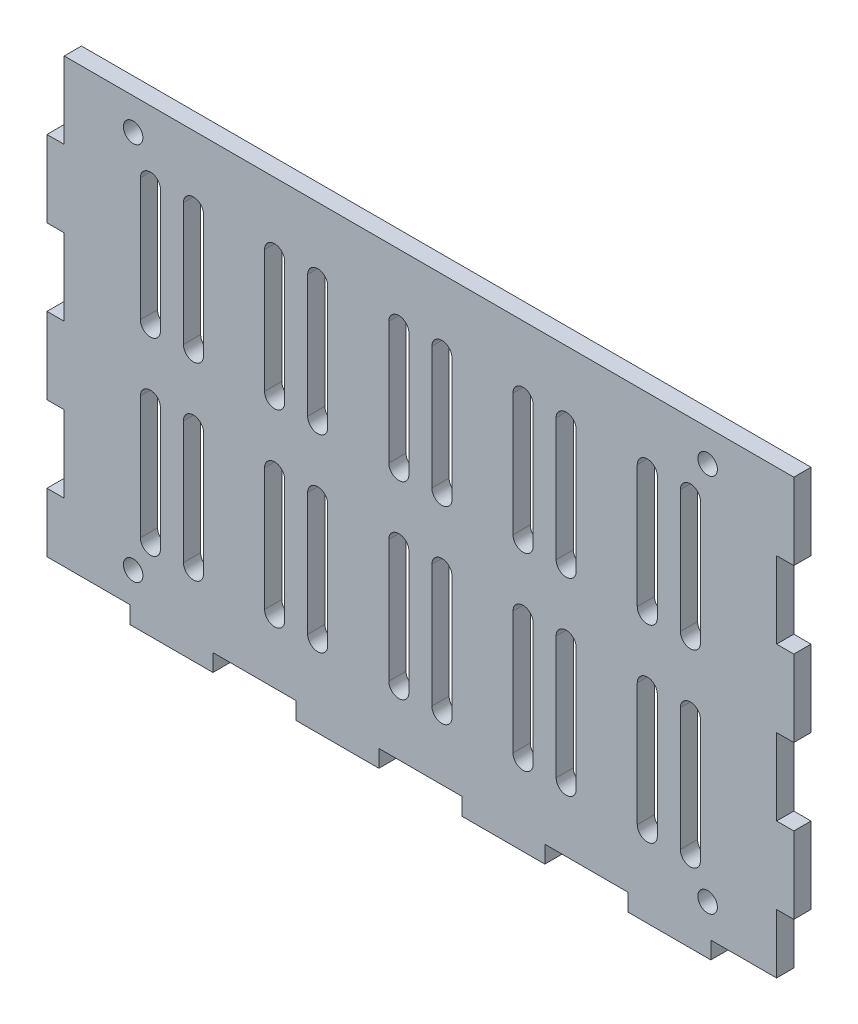
from build123d import *

# Parameters (mm, degrees)
SKETCH1_W               = 130
SKETCH1_H               = 80
BOSS_EXTRUDE1_DEPTH     = 3
SKETCH2_W               = 14.444444444
SKETCH2_H               = 3
SKETCH2_W_2             = 3
SKETCH2_H_2             = 13.333333334
SKETCH2_H_3             = 13.333333333
CUT_TABS_DEPTH          = 153.672852859
CORNERPIECE_HOLES_REACH = 154.673
SKETCH3_R               = 1.7
COOLING_SLOTS_REACH     = 154.673


with BuildPart() as part:
    # Sketch1 → Boss-Extrude1 (new body)
    with BuildSketch(Plane.XY):
        with Locations((65, 40)):
            Rectangle(SKETCH1_W, SKETCH1_H)
    extrude(amount=BOSS_EXTRUDE1_DEPTH)

    # Sketch2 → Cut tabs (cut, through all)
    with BuildSketch(Plane.XY.offset(3)):
        with Locations((7.222222222, 1.5)):
            Rectangle(SKETCH2_W, SKETCH2_H)
        with Locations((36.111111111, 1.5)):
            Rectangle(SKETCH2_W, SKETCH2_H)
        with Locations((65, 1.5)):
            Rectangle(SKETCH2_W, SKETCH2_H)
        with Locations((93.888888889, 1.5)):
            Rectangle(SKETCH2_W, SKETCH2_H)
        Polygon((115.555555556, 0), (115.555555556, 3), (127, 3), (127, 13.333333333), (130, 13.333333333), (130, 0), align=None)
        with Locations((1.5, 20)):
            Rectangle(SKETCH2_W_2, SKETCH2_H_2)
        with Locations((1.5, 46.666666667)):
            Rectangle(SKETCH2_W_2, SKETCH2_H_3)
        with Locations((1.5, 73.333333334)):
            Rectangle(SKETCH2_W_2, SKETCH2_H_3)
        with Locations((128.5, 33.333333334)):
            Rectangle(SKETCH2_W_2, SKETCH2_H_3)
        with Locations((128.5, 60)):
            Rectangle(SKETCH2_W_2, SKETCH2_H_2)
    extrude(amount=-CUT_TABS_DEPTH, mode=Mode.SUBTRACT)

    # Sketch3 → Cornerpiece holes (cut, up to next)
    with BuildSketch(Plane.XY.offset(3), mode=Mode.PRIVATE) as cornerpiece_holes_sk1:
        with Locations((15, 74.5)):
            Circle(SKETCH3_R)
    cornerpiece_holes_tool1 = extrude(cornerpiece_holes_sk1.sketch, amount=-CORNERPIECE_HOLES_REACH, mode=Mode.PRIVATE) & part.part
    # Sketch3 → Cornerpiece holes (cut, up to next)
    with BuildSketch(Plane.XY.offset(3), mode=Mode.PRIVATE) as cornerpiece_holes_sk2:
        with Locations((115, 74.5)):
            Circle(SKETCH3_R)
    cornerpiece_holes_tool2 = extrude(cornerpiece_holes_sk2.sketch, amount=-CORNERPIECE_HOLES_REACH, mode=Mode.PRIVATE) & part.part
    # Sketch3 → Cornerpiece holes (cut, up to next)
    with BuildSketch(Plane.XY.offset(3), mode=Mode.PRIVATE) as cornerpiece_holes_sk3:
        with Locations((15, 8.5)):
            Circle(SKETCH3_R)
    cornerpiece_holes_tool3 = extrude(cornerpiece_holes_sk3.sketch, amount=-CORNERPIECE_HOLES_REACH, mode=Mode.PRIVATE) & part.part
    # Sketch3 → Cornerpiece holes (cut, up to next)
    with BuildSketch(Plane.XY.offset(3), mode=Mode.PRIVATE) as cornerpiece_holes_sk4:
        with Locations((115, 8.5)):
            Circle(SKETCH3_R)
    cornerpiece_holes_tool4 = extrude(cornerpiece_holes_sk4.sketch, amount=-CORNERPIECE_HOLES_REACH, mode=Mode.PRIVATE) & part.part
    add(cornerpiece_holes_tool1.solids().sort_by_distance((15, 74.5, 3))[0], mode=Mode.SUBTRACT)
    add(cornerpiece_holes_tool2.solids().sort_by_distance((115, 74.5, 3))[0], mode=Mode.SUBTRACT)
    add(cornerpiece_holes_tool3.solids().sort_by_distance((15, 8.5, 3))[0], mode=Mode.SUBTRACT)
    add(cornerpiece_holes_tool4.solids().sort_by_distance((115, 8.5, 3))[0], mode=Mode.SUBTRACT)

    # Sketch4 → Cooling slots (cut, up to next)
    with BuildSketch(Plane.XY.offset(3), mode=Mode.PRIVATE) as cooling_slots_sk1:
        with BuildLine():
            Line((16.25, 14), (16.25, 35.375))
            ThreePointArc((16.25, 35.375), (18, 37.125), (19.75, 35.375))
            Line((19.75, 35.375), (19.75, 14))
            ThreePointArc((19.75, 14), (18, 12.25), (16.25, 14))
        make_face()
    cooling_slots_tool1 = extrude(cooling_slots_sk1.sketch, amount=-COOLING_SLOTS_REACH, mode=Mode.PRIVATE) & part.part
    # Sketch4 → Cooling slots (cut, up to next)
    with BuildSketch(Plane.XY.offset(3), mode=Mode.PRIVATE) as cooling_slots_sk2:
        with BuildLine():
            Line((16.25, 46.875), (16.25, 68.25))
            ThreePointArc((16.25, 68.25), (18, 70), (19.75, 68.25))
            Line((19.75, 68.25), (19.75, 46.875))
            ThreePointArc((19.75, 46.875), (18, 45.125), (16.25, 46.875))
        make_face()
    cooling_slots_tool2 = extrude(cooling_slots_sk2.sketch, amount=-COOLING_SLOTS_REACH, mode=Mode.PRIVATE) & part.part
    # Sketch4 → Cooling slots (cut, up to next)
    with BuildSketch(Plane.XY.offset(3), mode=Mode.PRIVATE) as cooling_slots_sk3:
        with BuildLine():
            Line((23.75, 14), (23.75, 35.375))
            ThreePointArc((23.75, 35.375), (25.5, 37.125), (27.25, 35.375))
            Line((27.25, 35.375), (27.25, 14))
            ThreePointArc((27.25, 14), (25.5, 12.25), (23.75, 14))
        make_face()
    cooling_slots_tool3 = extrude(cooling_slots_sk3.sketch, amount=-COOLING_SLOTS_REACH, mode=Mode.PRIVATE) & part.part
    # Sketch4 → Cooling slots (cut, up to next)
    with BuildSketch(Plane.XY.offset(3), mode=Mode.PRIVATE) as cooling_slots_sk4:
        with BuildLine():
            Line((23.75, 46.875), (23.75, 68.25))
            ThreePointArc((23.75, 68.25), (25.5, 70), (27.25, 68.25))
            Line((27.25, 68.25), (27.25, 46.875))
            ThreePointArc((27.25, 46.875), (25.5, 45.125), (23.75, 46.875))
        make_face()
    cooling_slots_tool4 = extrude(cooling_slots_sk4.sketch, amount=-COOLING_SLOTS_REACH, mode=Mode.PRIVATE) & part.part
    # Sketch4 → Cooling slots (cut, up to next)
    with BuildSketch(Plane.XY.offset(3), mode=Mode.PRIVATE) as cooling_slots_sk5:
        with BuildLine():
            Line((41.375, 14), (41.375, 35.375))
            ThreePointArc((41.375, 35.375), (39.625, 37.125), (37.875, 35.375))
            Line((37.875, 35.375), (37.875, 14))
            ThreePointArc((37.875, 14), (39.625, 12.25), (41.375, 14))
        make_face()
    cooling_slots_tool5 = extrude(cooling_slots_sk5.sketch, amount=-COOLING_SLOTS_REACH, mode=Mode.PRIVATE) & part.part
    # Sketch4 → Cooling slots (cut, up to next)
    with BuildSketch(Plane.XY.offset(3), mode=Mode.PRIVATE) as cooling_slots_sk6:
        with BuildLine():
            Line((48.875, 14), (48.875, 35.375))
            ThreePointArc((48.875, 35.375), (47.125, 37.125), (45.375, 35.375))
            Line((45.375, 35.375), (45.375, 14))
            ThreePointArc((45.375, 14), (47.125, 12.25), (48.875, 14))
        make_face()
    cooling_slots_tool6 = extrude(cooling_slots_sk6.sketch, amount=-COOLING_SLOTS_REACH, mode=Mode.PRIVATE) & part.part
    # Sketch4 → Cooling slots (cut, up to next)
    with BuildSketch(Plane.XY.offset(3), mode=Mode.PRIVATE) as cooling_slots_sk7:
        with BuildLine():
            Line((48.875, 46.875), (48.875, 68.25))
            ThreePointArc((48.875, 68.25), (47.125, 70), (45.375, 68.25))
            Line((45.375, 68.25), (45.375, 46.875))
            ThreePointArc((45.375, 46.875), (47.125, 45.125), (48.875, 46.875))
        make_face()
    cooling_slots_tool7 = extrude(cooling_slots_sk7.sketch, amount=-COOLING_SLOTS_REACH, mode=Mode.PRIVATE) & part.part
    # Sketch4 → Cooling slots (cut, up to next)
    with BuildSketch(Plane.XY.offset(3), mode=Mode.PRIVATE) as cooling_slots_sk8:
        with BuildLine():
            Line((41.375, 46.875), (41.375, 68.25))
            ThreePointArc((41.375, 68.25), (39.625, 70), (37.875, 68.25))
            Line((37.875, 68.25), (37.875, 46.875))
            ThreePointArc((37.875, 46.875), (39.625, 45.125), (41.375, 46.875))
        make_face()
    cooling_slots_tool8 = extrude(cooling_slots_sk8.sketch, amount=-COOLING_SLOTS_REACH, mode=Mode.PRIVATE) & part.part
    # Sketch4 → Cooling slots (cut, up to next)
    with BuildSketch(Plane.XY.offset(3), mode=Mode.PRIVATE) as cooling_slots_sk9:
        with BuildLine():
            Line((63, 14), (63, 35.375))
            ThreePointArc((63, 35.375), (61.25, 37.125), (59.5, 35.375))
            Line((59.5, 35.375), (59.5, 14))
            ThreePointArc((59.5, 14), (61.25, 12.25), (63, 14))
        make_face()
    cooling_slots_tool9 = extrude(cooling_slots_sk9.sketch, amount=-COOLING_SLOTS_REACH, mode=Mode.PRIVATE) & part.part
    # Sketch4 → Cooling slots (cut, up to next)
    with BuildSketch(Plane.XY.offset(3), mode=Mode.PRIVATE) as cooling_slots_sk10:
        with BuildLine():
            Line((70.5, 14), (70.5, 35.375))
            ThreePointArc((70.5, 35.375), (68.75, 37.125), (67, 35.375))
            Line((67, 35.375), (67, 14))
            ThreePointArc((67, 14), (68.75, 12.25), (70.5, 14))
        make_face()
    cooling_slots_tool10 = extrude(cooling_slots_sk10.sketch, amount=-COOLING_SLOTS_REACH, mode=Mode.PRIVATE) & part.part
    # Sketch4 → Cooling slots (cut, up to next)
    with BuildSketch(Plane.XY.offset(3), mode=Mode.PRIVATE) as cooling_slots_sk11:
        with BuildLine():
            Line((70.5, 46.875), (70.5, 68.25))
            ThreePointArc((70.5, 68.25), (68.75, 70), (67, 68.25))
            Line((67, 68.25), (67, 46.875))
            ThreePointArc((67, 46.875), (68.75, 45.125), (70.5, 46.875))
        make_face()
    cooling_slots_tool11 = extrude(cooling_slots_sk11.sketch, amount=-COOLING_SLOTS_REACH, mode=Mode.PRIVATE) & part.part
    # Sketch4 → Cooling slots (cut, up to next)
    with BuildSketch(Plane.XY.offset(3), mode=Mode.PRIVATE) as cooling_slots_sk12:
        with BuildLine():
            Line((63, 46.875), (63, 68.25))
            ThreePointArc((63, 68.25), (61.25, 70), (59.5, 68.25))
            Line((59.5, 68.25), (59.5, 46.875))
            ThreePointArc((59.5, 46.875), (61.25, 45.125), (63, 46.875))
        make_face()
    cooling_slots_tool12 = extrude(cooling_slots_sk12.sketch, amount=-COOLING_SLOTS_REACH, mode=Mode.PRIVATE) & part.part
    # Sketch4 → Cooling slots (cut, up to next)
    with BuildSketch(Plane.XY.offset(3), mode=Mode.PRIVATE) as cooling_slots_sk13:
        with BuildLine():
            Line((84.625, 14), (84.625, 35.375))
            ThreePointArc((84.625, 35.375), (82.875, 37.125), (81.125, 35.375))
            Line((81.125, 35.375), (81.125, 14))
            ThreePointArc((81.125, 14), (82.875, 12.25), (84.625, 14))
        make_face()
    cooling_slots_tool13 = extrude(cooling_slots_sk13.sketch, amount=-COOLING_SLOTS_REACH, mode=Mode.PRIVATE) & part.part
    # Sketch4 → Cooling slots (cut, up to next)
    with BuildSketch(Plane.XY.offset(3), mode=Mode.PRIVATE) as cooling_slots_sk14:
        with BuildLine():
            Line((92.125, 14), (92.125, 35.375))
            ThreePointArc((92.125, 35.375), (90.375, 37.125), (88.625, 35.375))
            Line((88.625, 35.375), (88.625, 14))
            ThreePointArc((88.625, 14), (90.375, 12.25), (92.125, 14))
        make_face()
    cooling_slots_tool14 = extrude(cooling_slots_sk14.sketch, amount=-COOLING_SLOTS_REACH, mode=Mode.PRIVATE) & part.part
    # Sketch4 → Cooling slots (cut, up to next)
    with BuildSketch(Plane.XY.offset(3), mode=Mode.PRIVATE) as cooling_slots_sk15:
        with BuildLine():
            Line((92.125, 46.875), (92.125, 68.25))
            ThreePointArc((92.125, 68.25), (90.375, 70), (88.625, 68.25))
            Line((88.625, 68.25), (88.625, 46.875))
            ThreePointArc((88.625, 46.875), (90.375, 45.125), (92.125, 46.875))
        make_face()
    cooling_slots_tool15 = extrude(cooling_slots_sk15.sketch, amount=-COOLING_SLOTS_REACH, mode=Mode.PRIVATE) & part.part
    # Sketch4 → Cooling slots (cut, up to next)
    with BuildSketch(Plane.XY.offset(3), mode=Mode.PRIVATE) as cooling_slots_sk16:
        with BuildLine():
            Line((84.625, 46.875), (84.625, 68.25))
            ThreePointArc((84.625, 68.25), (82.875, 70), (81.125, 68.25))
            Line((81.125, 68.25), (81.125, 46.875))
            ThreePointArc((81.125, 46.875), (82.875, 45.125), (84.625, 46.875))
        make_face()
    cooling_slots_tool16 = extrude(cooling_slots_sk16.sketch, amount=-COOLING_SLOTS_REACH, mode=Mode.PRIVATE) & part.part
    # Sketch4 → Cooling slots (cut, up to next)
    with BuildSketch(Plane.XY.offset(3), mode=Mode.PRIVATE) as cooling_slots_sk17:
        with BuildLine():
            Line((106.25, 14), (106.25, 35.375))
            ThreePointArc((106.25, 35.375), (104.5, 37.125), (102.75, 35.375))
            Line((102.75, 35.375), (102.75, 14))
            ThreePointArc((102.75, 14), (104.5, 12.25), (106.25, 14))
        make_face()
    cooling_slots_tool17 = extrude(cooling_slots_sk17.sketch, amount=-COOLING_SLOTS_REACH, mode=Mode.PRIVATE) & part.part
    # Sketch4 → Cooling slots (cut, up to next)
    with BuildSketch(Plane.XY.offset(3), mode=Mode.PRIVATE) as cooling_slots_sk18:
        with BuildLine():
            Line((113.75, 14), (113.75, 35.375))
            ThreePointArc((113.75, 35.375), (112, 37.125), (110.25, 35.375))
            Line((110.25, 35.375), (110.25, 14))
            ThreePointArc((110.25, 14), (112, 12.25), (113.75, 14))
        make_face()
    cooling_slots_tool18 = extrude(cooling_slots_sk18.sketch, amount=-COOLING_SLOTS_REACH, mode=Mode.PRIVATE) & part.part
    # Sketch4 → Cooling slots (cut, up to next)
    with BuildSketch(Plane.XY.offset(3), mode=Mode.PRIVATE) as cooling_slots_sk19:
        with BuildLine():
            Line((113.75, 46.875), (113.75, 68.25))
            ThreePointArc((113.75, 68.25), (112, 70), (110.25, 68.25))
            Line((110.25, 68.25), (110.25, 46.875))
            ThreePointArc((110.25, 46.875), (112, 45.125), (113.75, 46.875))
        make_face()
    cooling_slots_tool19 = extrude(cooling_slots_sk19.sketch, amount=-COOLING_SLOTS_REACH, mode=Mode.PRIVATE) & part.part
    # Sketch4 → Cooling slots (cut, up to next)
    with BuildSketch(Plane.XY.offset(3), mode=Mode.PRIVATE) as cooling_slots_sk20:
        with BuildLine():
            Line((106.25, 46.875), (106.25, 68.25))
            ThreePointArc((106.25, 68.25), (104.5, 70), (102.75, 68.25))
            Line((102.75, 68.25), (102.75, 46.875))
            ThreePointArc((102.75, 46.875), (104.5, 45.125), (106.25, 46.875))
        make_face()
    cooling_slots_tool20 = extrude(cooling_slots_sk20.sketch, amount=-COOLING_SLOTS_REACH, mode=Mode.PRIVATE) & part.part
    add(cooling_slots_tool1.solids().sort_by_distance((18, 24.6875, 3))[0], mode=Mode.SUBTRACT)
    add(cooling_slots_tool2.solids().sort_by_distance((18, 57.5625, 3))[0], mode=Mode.SUBTRACT)
    add(cooling_slots_tool3.solids().sort_by_distance((25.5, 24.6875, 3))[0], mode=Mode.SUBTRACT)
    add(cooling_slots_tool4.solids().sort_by_distance((25.5, 57.5625, 3))[0], mode=Mode.SUBTRACT)
    add(cooling_slots_tool5.solids().sort_by_distance((39.625, 24.6875, 3))[0], mode=Mode.SUBTRACT)
    add(cooling_slots_tool6.solids().sort_by_distance((47.125, 24.6875, 3))[0], mode=Mode.SUBTRACT)
    add(cooling_slots_tool7.solids().sort_by_distance((47.125, 57.5625, 3))[0], mode=Mode.SUBTRACT)
    add(cooling_slots_tool8.solids().sort_by_distance((39.625, 57.5625, 3))[0], mode=Mode.SUBTRACT)
    add(cooling_slots_tool9.solids().sort_by_distance((61.25, 24.6875, 3))[0], mode=Mode.SUBTRACT)
    add(cooling_slots_tool10.solids().sort_by_distance((68.75, 24.6875, 3))[0], mode=Mode.SUBTRACT)
    add(cooling_slots_tool11.solids().sort_by_distance((68.75, 57.5625, 3))[0], mode=Mode.SUBTRACT)
    add(cooling_slots_tool12.solids().sort_by_distance((61.25, 57.5625, 3))[0], mode=Mode.SUBTRACT)
    add(cooling_slots_tool13.solids().sort_by_distance((82.875, 24.6875, 3))[0], mode=Mode.SUBTRACT)
    add(cooling_slots_tool14.solids().sort_by_distance((90.375, 24.6875, 3))[0], mode=Mode.SUBTRACT)
    add(cooling_slots_tool15.solids().sort_by_distance((90.375, 57.5625, 3))[0], mode=Mode.SUBTRACT)
    add(cooling_slots_tool16.solids().sort_by_distance((82.875, 57.5625, 3))[0], mode=Mode.SUBTRACT)
    add(cooling_slots_tool17.solids().sort_by_distance((104.5, 24.6875, 3))[0], mode=Mode.SUBTRACT)
    add(cooling_slots_tool18.solids().sort_by_distance((112, 24.6875, 3))[0], mode=Mode.SUBTRACT)
    add(cooling_slots_tool19.solids().sort_by_distance((112, 57.5625, 3))[0], mode=Mode.SUBTRACT)
    add(cooling_slots_tool20.solids().sort_by_distance((104.5, 57.5625, 3))[0], mode=Mode.SUBTRACT)


solid = part.part
